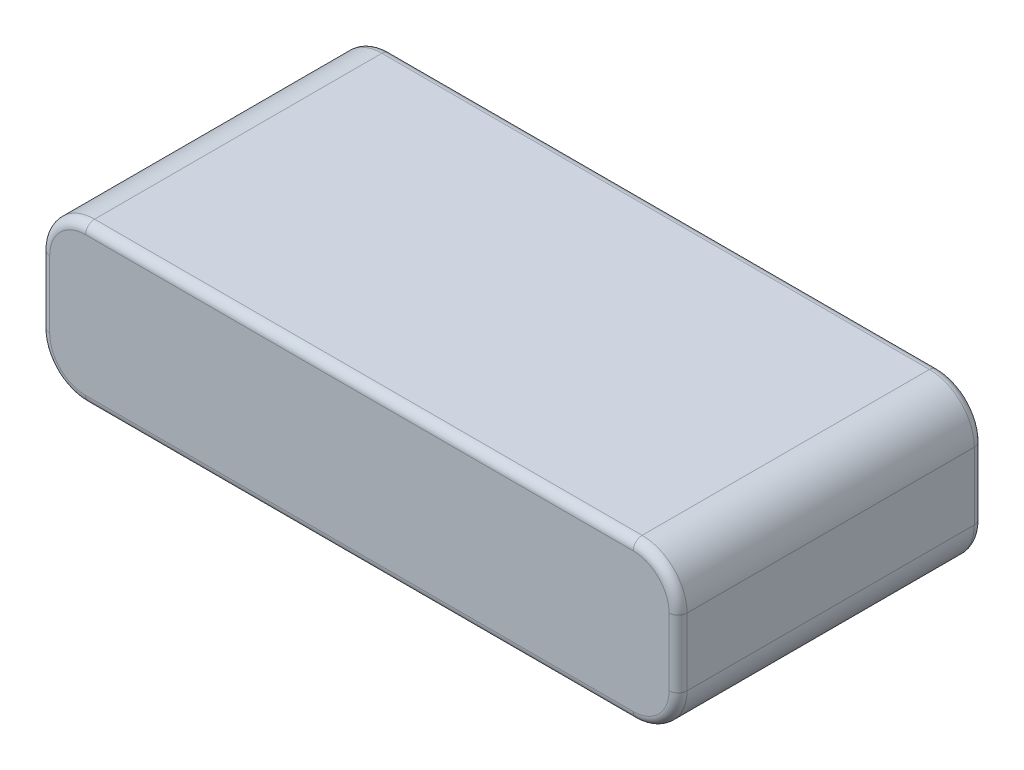
from build123d import *

# Parameters (mm, degrees)
SKETCH1_W           = 71
SKETCH1_H           = 34
BOSS_EXTRUDE1_DEPTH = 17.5
FILLET1_R           = 5
FILLET2_R           = 1


with BuildPart() as part:
    # Sketch1 → Boss-Extrude1 (new body)
    with BuildSketch(Plane(origin=(0, 0, 0), x_dir=(1, 0, 0), z_dir=(0, 1, 0))):
        Rectangle(SKETCH1_W, SKETCH1_H)
    extrude(amount=BOSS_EXTRUDE1_DEPTH)

    # Fillet1
    fillet1_edges = [part.edges().sort_by_distance(p)[0] for p in [
        (35.5, 17.5, 0),
        (-35.5, 17.5, 0),
        (35.5, 0, 0),
        (-35.5, 0, 0),
    ]]
    fillet(fillet1_edges, radius=FILLET1_R)

    # Fillet2
    fillet2_edges = [part.edges().sort_by_distance(p)[0] for p in [
        (35.5, 8.75, -17),
        (35.5, 8.75, 17),
        (0, 0, -17),
        (-35.5, 8.75, -17),
        (0, 17.5, -17),
        (-34.035533906, 16.035533906, -17),
        (-34.035533906, 1.464466094, -17),
        (34.035533906, 16.035533906, -17),
        (34.035533906, 1.464466094, -17),
        (0, 0, 17),
        (0, 17.5, 17),
        (-35.5, 8.75, 17),
        (-34.035533906, 16.035533906, 17),
        (-34.035533906, 1.464466094, 17),
        (34.035533906, 16.035533906, 17),
        (34.035533906, 1.464466094, 17),
    ]]
    fillet(fillet2_edges, radius=FILLET2_R)


solid = part.part
